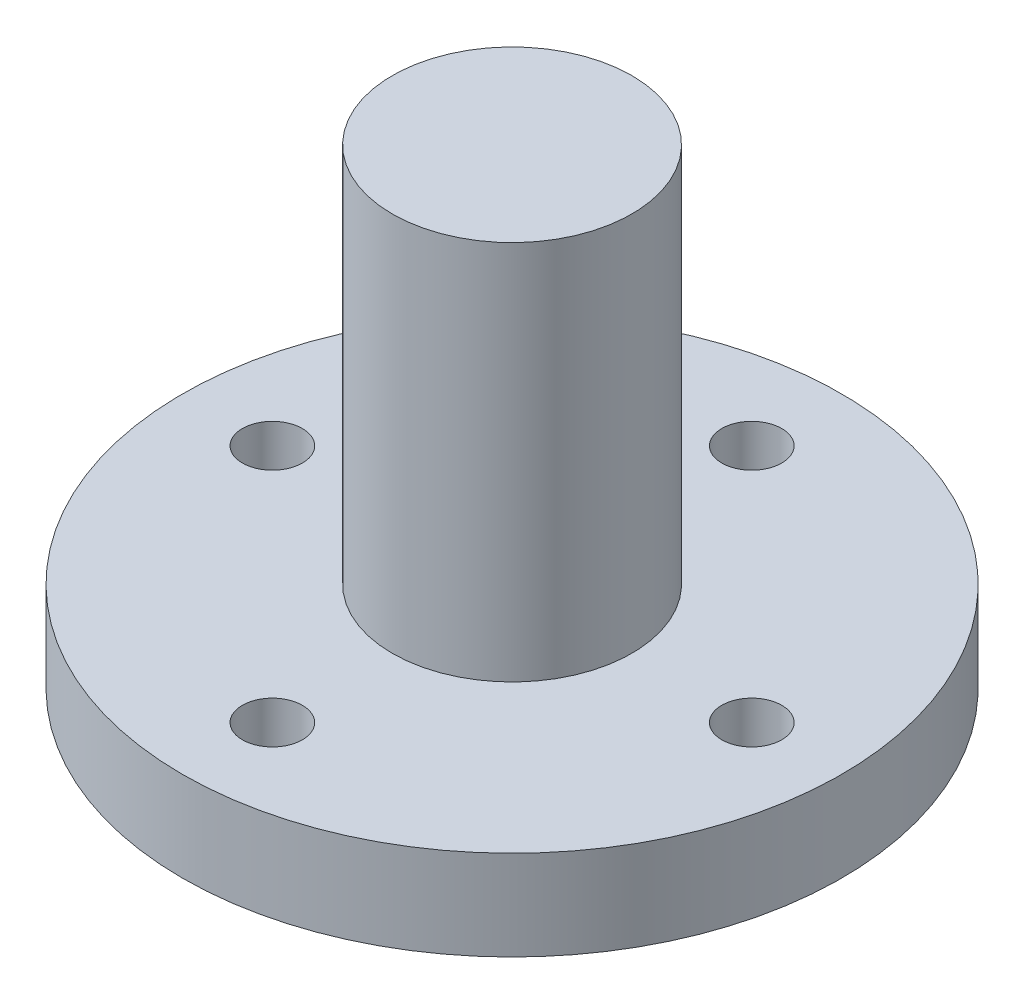
from build123d import *

# Parameters (mm, degrees)
SKETCH1_R           = 11
SKETCH1_R_2         = 1
BOSS_EXTRUDE1_DEPTH = 3
SKETCH2_R           = 4
BOSS_EXTRUDE2_DEPTH = 12.7


with BuildPart() as part:
    # Sketch1 → Boss-Extrude1 (new body)
    with BuildSketch(Plane(origin=(0, 0, 0), x_dir=(1, 0, 0), z_dir=(0, 1, 0))):
        with Locations(Location((0, 0, 0), (0, 0, 270))):
            Circle(SKETCH1_R)
        with Locations(Location((0, 8, 0), (0, 0, 270))):
            Circle(SKETCH1_R_2, mode=Mode.SUBTRACT)
        with Locations(Location((8, 0, 0), (0, 0, 270))):
            Circle(SKETCH1_R_2, mode=Mode.SUBTRACT)
        with Locations(Location((0, -8, 0), (0, 0, 270))):
            Circle(SKETCH1_R_2, mode=Mode.SUBTRACT)
        with Locations(Location((-8, 0, 0), (0, 0, 270))):
            Circle(SKETCH1_R_2, mode=Mode.SUBTRACT)
    extrude(amount=BOSS_EXTRUDE1_DEPTH)

    # Sketch2 → Boss-Extrude2 (add)
    with BuildSketch(Plane(origin=(0, 3, 0), x_dir=(1, 0, 0), z_dir=(0, 1, 0))):
        with Locations(Location((0, 0, 0), (0, 0, 270))):
            Circle(SKETCH2_R)
    extrude(amount=BOSS_EXTRUDE2_DEPTH)


solid = part.part
